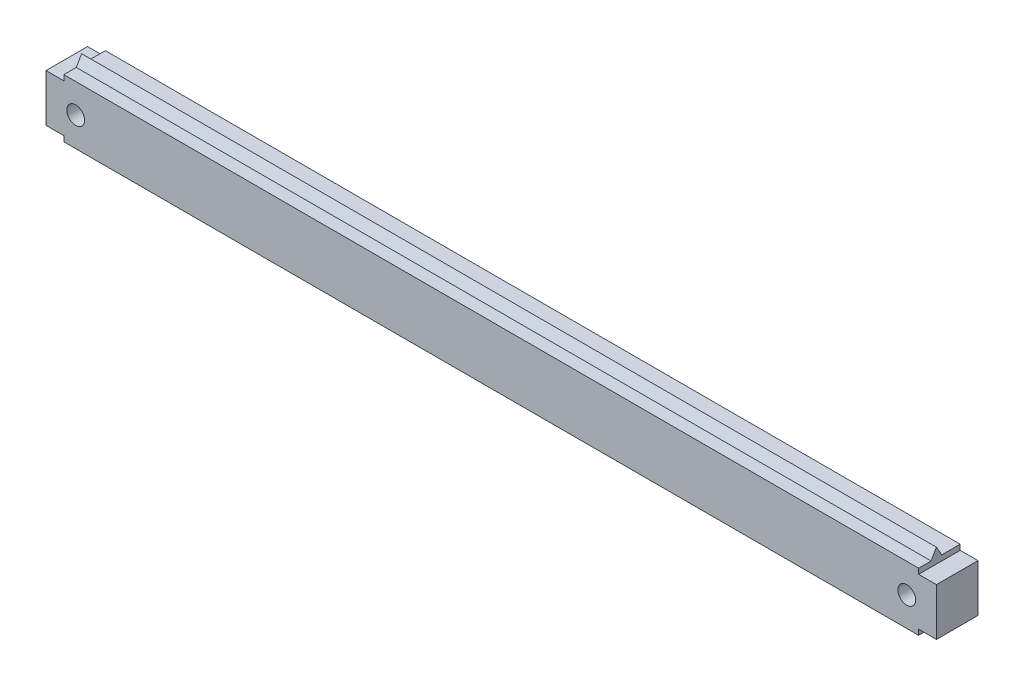
from build123d import *

# Parameters (mm, degrees)
SKETCH_1_W          = 150
SKETCH_1_H          = 18
EXTRUDE_1_DEPTH     = 7
CUT_EXTRUDE_1_REACH = 153.238
SKETCH_3_R          = 1.5
CUT_EXTRUDE_2_REACH = 153.238
CUT_EXTRUDE_3_REACH = 152.957
SKETCH_5_W          = 3
SKETCH_5_H          = 2.458845727
SKETCH_6_R          = 3
CUT_EXTRUDE_4_DEPTH = 3


with BuildPart() as part:
    # 草图1 → 凸台-拉伸1 (new body)
    with BuildSketch(Plane.XY):
        with Locations((75, 9)):
            Rectangle(SKETCH_1_W, SKETCH_1_H)
    extrude(amount=EXTRUDE_1_DEPTH)

    # 草图3 → 切除-拉伸1 (cut, up to next)
    with BuildSketch(Plane.XY.offset(7), mode=Mode.PRIVATE) as cut_extrude_1_sk1:
        with Locations((5, 9)):
            Circle(SKETCH_3_R)
    cut_extrude_1_tool1 = extrude(cut_extrude_1_sk1.sketch, amount=-CUT_EXTRUDE_1_REACH, mode=Mode.PRIVATE) & part.part
    # 草图3 → 切除-拉伸1 (cut, up to next)
    with BuildSketch(Plane.XY.offset(7), mode=Mode.PRIVATE) as cut_extrude_1_sk2:
        with Locations(Location((145, 9, 0), (0, 0, 180))):
            Circle(SKETCH_3_R)
    cut_extrude_1_tool2 = extrude(cut_extrude_1_sk2.sketch, amount=-CUT_EXTRUDE_1_REACH, mode=Mode.PRIVATE) & part.part
    add(cut_extrude_1_tool1.solids().sort_by_distance((5, 9, 7))[0], mode=Mode.SUBTRACT)
    add(cut_extrude_1_tool2.solids().sort_by_distance((145, 9, 7))[0], mode=Mode.SUBTRACT)

    # 草图2 → 切除-拉伸2 (cut, up to next)
    with BuildSketch(Plane(origin=(150, 0, 0), x_dir=(0, 0, -1), z_dir=(1, 0, 0)), mode=Mode.PRIVATE) as cut_extrude_2_sk1:
        Polygon((-7, 18), (-7, 13.9), (-4.9, 13.9), (-4, 15.458845727), (-3.1, 13.9), (0, 13.9), (0, 18), align=None)
    cut_extrude_2_tool1 = extrude(cut_extrude_2_sk1.sketch, amount=-CUT_EXTRUDE_2_REACH, mode=Mode.PRIVATE) & part.part
    # 草图2 → 切除-拉伸2 (cut, up to next)
    with BuildSketch(Plane(origin=(150, 0, 0), x_dir=(0, 0, -1), z_dir=(1, 0, 0)), mode=Mode.PRIVATE) as cut_extrude_2_sk2:
        Polygon((-4.9, 4.1), (-7, 4.1), (-7, 0), (0, 0), (0, 4.1), (-3.1, 4.1), (-4, 2.541154273), align=None)
    cut_extrude_2_tool2 = extrude(cut_extrude_2_sk2.sketch, amount=-CUT_EXTRUDE_2_REACH, mode=Mode.PRIVATE) & part.part
    add(cut_extrude_2_tool1.solids().sort_by_distance((150, 16.028656, 3.474302))[0], mode=Mode.SUBTRACT)
    add(cut_extrude_2_tool2.solids().sort_by_distance((150, 1.971344, 3.474302))[0], mode=Mode.SUBTRACT)

    # 草图5 → 切除-拉伸3 (cut, up to next)
    with BuildSketch(Plane.XY.offset(7), mode=Mode.PRIVATE) as cut_extrude_3_sk1:
        with Locations((1.5, 14.229422864)):
            Rectangle(SKETCH_5_W, SKETCH_5_H)
    cut_extrude_3_tool1 = extrude(cut_extrude_3_sk1.sketch, amount=-CUT_EXTRUDE_3_REACH, mode=Mode.PRIVATE) & part.part
    # 草图5 → 切除-拉伸3 (cut, up to next)
    with BuildSketch(Plane.XY.offset(7), mode=Mode.PRIVATE) as cut_extrude_3_sk2:
        with Locations((1.5, 3.770577137)):
            Rectangle(SKETCH_5_W, SKETCH_5_H)
    cut_extrude_3_tool2 = extrude(cut_extrude_3_sk2.sketch, amount=-CUT_EXTRUDE_3_REACH, mode=Mode.PRIVATE) & part.part
    # 草图5 → 切除-拉伸3 (cut, up to next)
    with BuildSketch(Plane.XY.offset(7), mode=Mode.PRIVATE) as cut_extrude_3_sk3:
        with Locations((148.5, 3.770577137)):
            Rectangle(SKETCH_5_W, SKETCH_5_H)
    cut_extrude_3_tool3 = extrude(cut_extrude_3_sk3.sketch, amount=-CUT_EXTRUDE_3_REACH, mode=Mode.PRIVATE) & part.part
    # 草图5 → 切除-拉伸3 (cut, up to next)
    with BuildSketch(Plane.XY.offset(7), mode=Mode.PRIVATE) as cut_extrude_3_sk4:
        with Locations((148.5, 14.229422864)):
            Rectangle(SKETCH_5_W, SKETCH_5_H)
    cut_extrude_3_tool4 = extrude(cut_extrude_3_sk4.sketch, amount=-CUT_EXTRUDE_3_REACH, mode=Mode.PRIVATE) & part.part
    add(cut_extrude_3_tool1.solids().sort_by_distance((1.5, 14.229423, 7))[0], mode=Mode.SUBTRACT)
    add(cut_extrude_3_tool2.solids().sort_by_distance((1.5, 3.770577, 7))[0], mode=Mode.SUBTRACT)
    add(cut_extrude_3_tool3.solids().sort_by_distance((148.5, 3.770577, 7))[0], mode=Mode.SUBTRACT)
    add(cut_extrude_3_tool4.solids().sort_by_distance((148.5, 14.229423, 7))[0], mode=Mode.SUBTRACT)

    # 草图6 → 切除-拉伸4 (cut)
    with BuildSketch(Plane(origin=(0, 0, 0), x_dir=(-1, 0, 0), z_dir=(0, 0, -1))):
        with Locations((-105, 9)):
            Circle(SKETCH_6_R)
        with Locations((-45, 9)):
            Circle(SKETCH_6_R)
    extrude(amount=-CUT_EXTRUDE_4_DEPTH, mode=Mode.SUBTRACT)


solid = part.part
